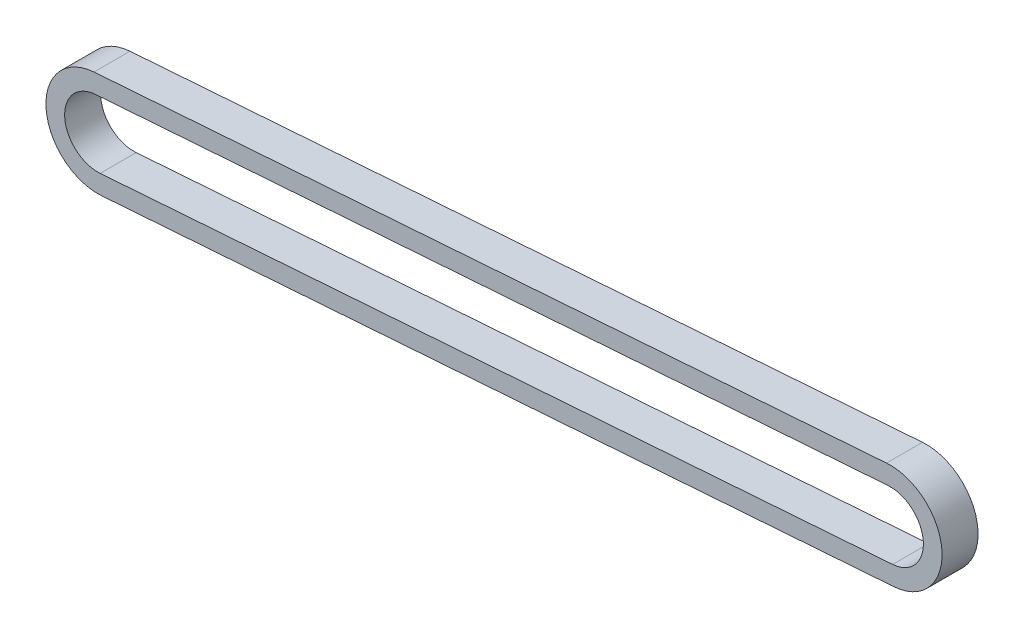
from build123d import *

# Parameters (mm, degrees)
BOSS_EXTRUDE1_DEPTH = 3.175


with BuildPart() as part:
    # Sketch1 → Boss-Extrude1 (new body)
    with BuildSketch(Plane.XY):
        with BuildLine():
            Line((69.588395423, 9.63998042), (-0.331304348, 4.55998042))
            ThreePointArc((-0.331304348, 4.55998042), (-4.55998042, -0.331304348), (0.331304348, -4.55998042))
            Line((0.331304348, -4.55998042), (70.251004118, 0.52001958))
            ThreePointArc((70.251004118, 0.52001958), (74.47968019, 5.411304348), (69.588395423, 9.63998042))
        make_face()
        with BuildLine():
            Line((0.211666667, -2.913320824), (70.131366437, 2.166679176))
            ThreePointArc((70.131366437, 2.166679176), (72.833020594, 5.291666667), (69.708033104, 7.993320824))
            Line((69.708033104, 7.993320824), (-0.211666667, 2.913320824))
            ThreePointArc((-0.211666667, 2.913320824), (-2.913320824, -0.211666667), (0.211666667, -2.913320824))
        make_face(mode=Mode.SUBTRACT)
    extrude(amount=BOSS_EXTRUDE1_DEPTH)


solid = part.part
